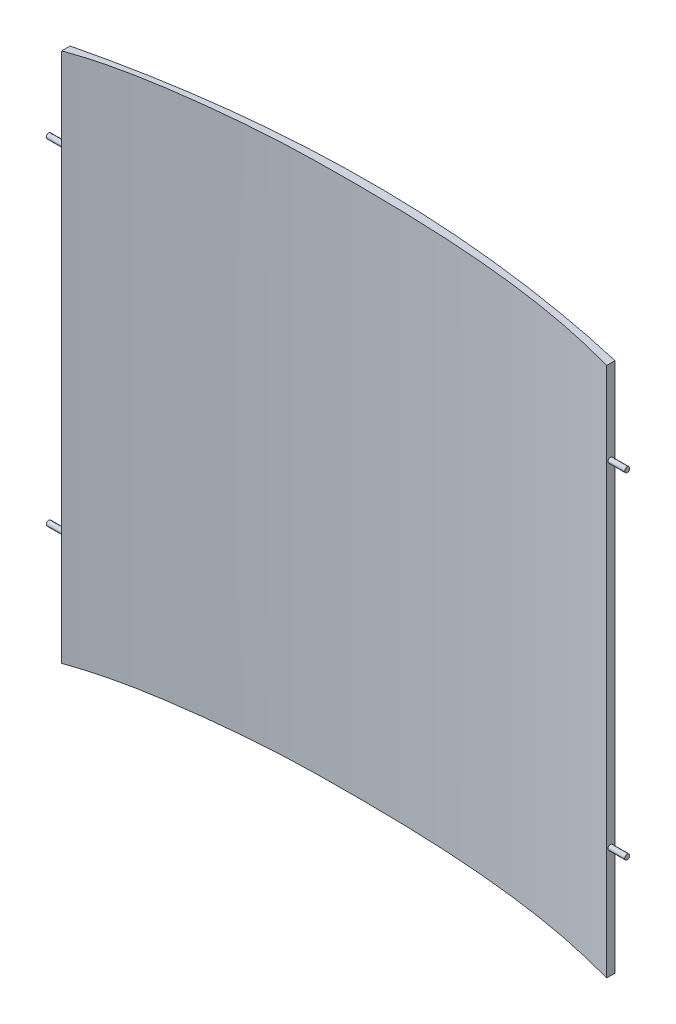
from build123d import *

# Parameters (mm, degrees)
SKETCH1_W           = 650
SKETCH1_H           = 632.74084605
BOSS_EXTRUDE1_DEPTH = 100
CUT_EXTRUDE1_DEPTH  = 727
SKETCH3_R           = 3
BOSS_EXTRUDE2_DEPTH = 20


with BuildPart() as part:
    # Sketch1 → Boss-Extrude1 (new body)
    with BuildSketch(Plane.XY):
        Rectangle(SKETCH1_W, SKETCH1_H)
    extrude(amount=BOSS_EXTRUDE1_DEPTH)

    # Sketch2 → Cut-Extrude1 (cut)
    with BuildSketch(Plane(origin=(0, 316.370423025, 0), x_dir=(1, 0, 0), z_dir=(0, 1, 0))):
        with BuildLine():
            Line((-325, -50), (-325, 0))
            Line((-325, 0), (325, 0))
            Line((325, 0), (325, -50))
            add(Edge.make_bspline(
                [(-325, -50), (-8.161544517, 26.403896699), (325, -50)],
                knots=[0, 0, 0, 1, 1, 1], degree=2))
        make_face()
        with BuildLine():
            Line((-325, -60.001868478), (-325, -100))
            Line((-325, -100), (325, -100))
            Line((325, -100), (325, -60.001868478))
            add(Edge.make_bspline(
                [(-325, -60.001868478), (-285.720204312, -45.917287881), (-211.55133421, -32.961852907), (-108.286436325, -22.797646377), (68.945530872, -20.464192827), (213.03755174, -28.371598233), (325, -60.001868478)],
                knots=[0, 0, 0, 0, 0.190276697, 0.342513028, 0.474089675, 1, 1, 1, 1], degree=3))
        make_face()
    extrude(amount=-CUT_EXTRUDE1_DEPTH, mode=Mode.SUBTRACT)

    # Sketch3 → Boss-Extrude2 (add)
    with BuildSketch(Plane(origin=(325, 0, 0), x_dir=(0, 0, -1), z_dir=(1, 0, 0))):
        with Locations(Location((-55.461648596, 216.370423025, 0), (0, 0, 180))):
            Circle(SKETCH3_R)
        with Locations(Location((-55.461648596, -183.629576975, 0), (0, 0, 180))):
            Circle(SKETCH3_R)
    boss_extrude2 = extrude(amount=BOSS_EXTRUDE2_DEPTH)

    # Mirror1: Boss-Extrude2 across plane
    add(boss_extrude2.mirror(Plane(origin=(0, 0, 0), x_dir=(0, 0, 1), z_dir=(1, 0, 0))))


solid = part.part
